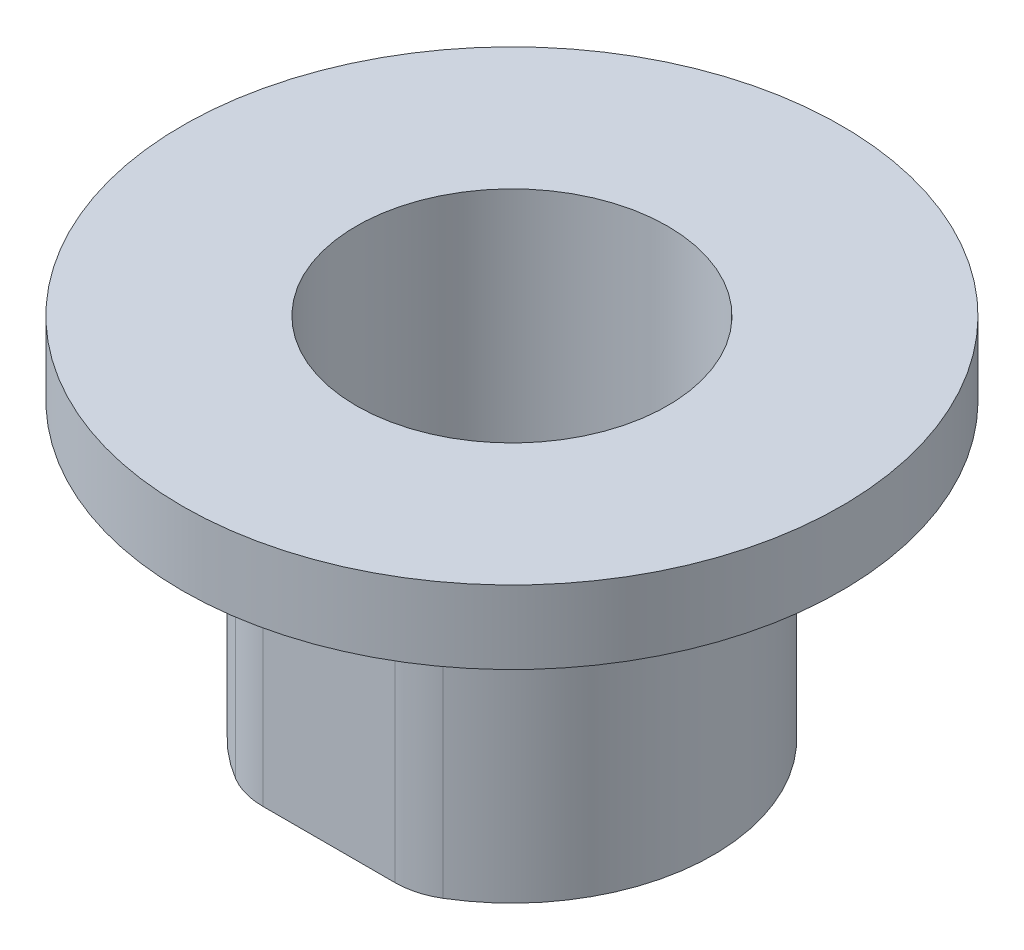
from build123d import *

# Parameters (mm, degrees)
BOSS_EXTRUDE1_DEPTH = 10
SKETCH2_R           = 4.25
CUT_EXTRUDE1_DEPTH  = 9
BOSS_EXTRUDE2_START = -2
SKETCH3_R           = 9
BOSS_EXTRUDE2_DEPTH = 2


with BuildPart() as part:
    # Sketch1 → Boss-Extrude1 (new body)
    with BuildSketch(Plane(origin=(0, 0, 0), x_dir=(1, 0, 0), z_dir=(0, 1, 0))):
        with BuildLine():
            Line((1.802775638, -5), (-1.802775638, -5))
            ThreePointArc((-1.802775638, -5), (-2.337298122, -4.927248223), (-2.832933145, -4.714285714))
            ThreePointArc((-2.832933145, -4.714285714), (0, 5.5), (2.832933145, -4.714285714))
            ThreePointArc((2.832933145, -4.714285714), (2.337298122, -4.927248223), (1.802775638, -5))
        make_face()
    extrude(amount=BOSS_EXTRUDE1_DEPTH)

    # Sketch2 → Cut-Extrude1 (cut)
    with BuildSketch(Plane(origin=(0, 10, 0), x_dir=(1, 0, 0), z_dir=(0, 1, 0))):
        with Locations(Location((0, 0, 0), (0, 0, 270))):
            Circle(SKETCH2_R)
    extrude(amount=-CUT_EXTRUDE1_DEPTH, mode=Mode.SUBTRACT)

    # Sketch3 → Boss-Extrude2 (add)
    with BuildSketch(Plane(origin=(0, 10, 0), x_dir=(1, 0, 0), z_dir=(0, 1, 0)).offset(BOSS_EXTRUDE2_START)):
        with Locations(Location((0, 0, 0), (0, 0, 270))):
            Circle(SKETCH3_R)
        with BuildLine():
            Line((1.802775638, -5), (-1.802775638, -5))
            ThreePointArc((-1.802775638, -5), (-2.337298122, -4.927248223), (-2.832933145, -4.714285714))
            ThreePointArc((-2.832933145, -4.714285714), (0, 5.5), (2.832933145, -4.714285714))
            ThreePointArc((2.832933145, -4.714285714), (2.337298122, -4.927248223), (1.802775638, -5))
        make_face(mode=Mode.SUBTRACT)
    extrude(amount=BOSS_EXTRUDE2_DEPTH)


solid = part.part
